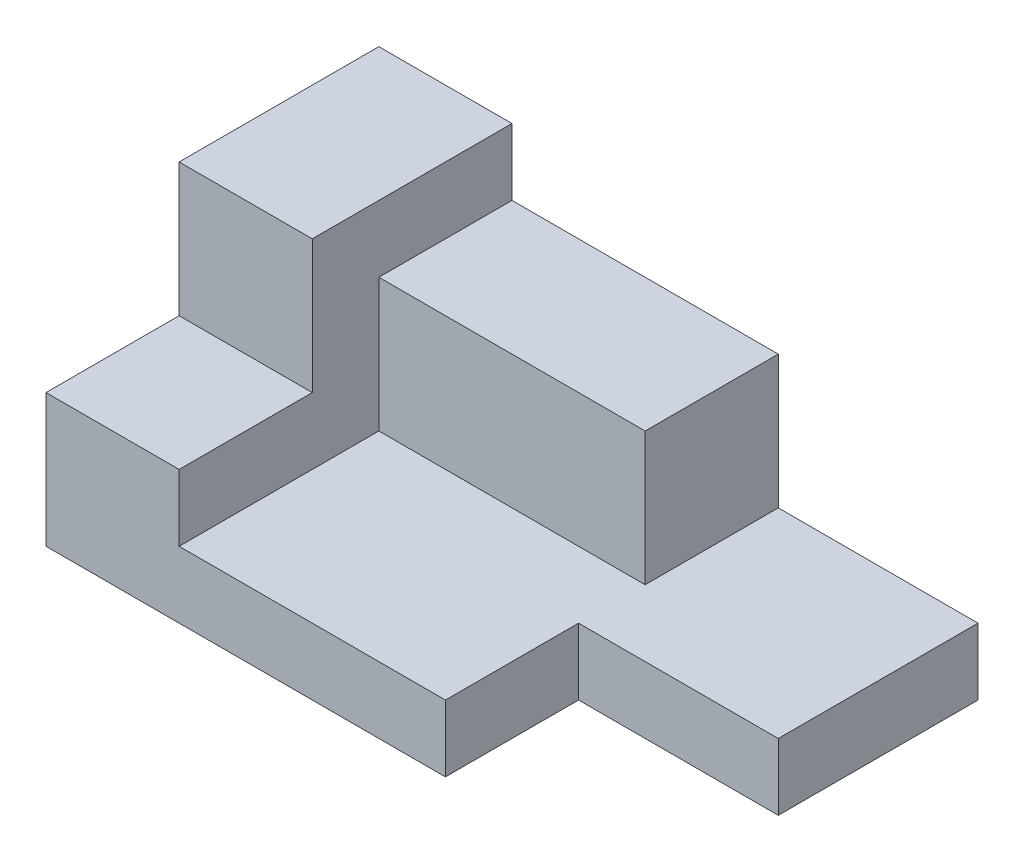
from build123d import *

# Parameters (mm, degrees)
SKETCH2_W           = 40
SKETCH2_H           = 20
SKETCH2_W_2         = 20
BOSS_EXTRUDE1_DEPTH = 10
BOSS_EXTRUDE2_START = 10
SKETCH2_3_W         = 40
SKETCH2_3_H         = 20
BOSS_EXTRUDE2_DEPTH = 20
BOSS_EXTRUDE3_START = 10
BOSS_EXTRUDE3_DEPTH = 30
BOSS_EXTRUDE4_START = 10
SKETCH2_5_W         = 20
SKETCH2_5_H         = 20
BOSS_EXTRUDE4_DEPTH = 10


with BuildPart() as part:
    # Sketch2 → Boss-Extrude1 (new body)
    with BuildSketch(Plane(origin=(0, 0, 0), x_dir=(1, 0, 0), z_dir=(0, 1, 0))):
        Polygon((60, 50), (60, 30), (60, 20), (90, 20), (90, 50), align=None)
        with Locations((40, 40)):
            Rectangle(SKETCH2_W, SKETCH2_H)
        Polygon((0, 20), (20, 20), (20, 30), (20, 50), (0, 50), align=None)
        Polygon((20, 30), (20, 20), (20, 0), (60, 0), (60, 20), (60, 30), align=None)
        with Locations((10, 10)):
            Rectangle(SKETCH2_W_2, SKETCH2_H)
    extrude(amount=BOSS_EXTRUDE1_DEPTH)

    # Sketch2<3> → Boss-Extrude2 (add)
    with BuildSketch(Plane(origin=(0, 0, 0), x_dir=(1, 0, 0), z_dir=(0, 1, 0)).offset(BOSS_EXTRUDE2_START)):
        with Locations((40, 40)):
            Rectangle(SKETCH2_3_W, SKETCH2_3_H)
    extrude(amount=BOSS_EXTRUDE2_DEPTH)

    # Sketch2<4> → Boss-Extrude3 (add)
    with BuildSketch(Plane(origin=(0, 0, 0), x_dir=(1, 0, 0), z_dir=(0, 1, 0)).offset(BOSS_EXTRUDE3_START)):
        Polygon((0, 20), (20, 20), (20, 30), (20, 50), (0, 50), align=None)
    extrude(amount=BOSS_EXTRUDE3_DEPTH)

    # Sketch2<5> → Boss-Extrude4 (add)
    with BuildSketch(Plane(origin=(0, 0, 0), x_dir=(1, 0, 0), z_dir=(0, 1, 0)).offset(BOSS_EXTRUDE4_START)):
        with Locations((10, 10)):
            Rectangle(SKETCH2_5_W, SKETCH2_5_H)
    extrude(amount=BOSS_EXTRUDE4_DEPTH)


solid = part.part
